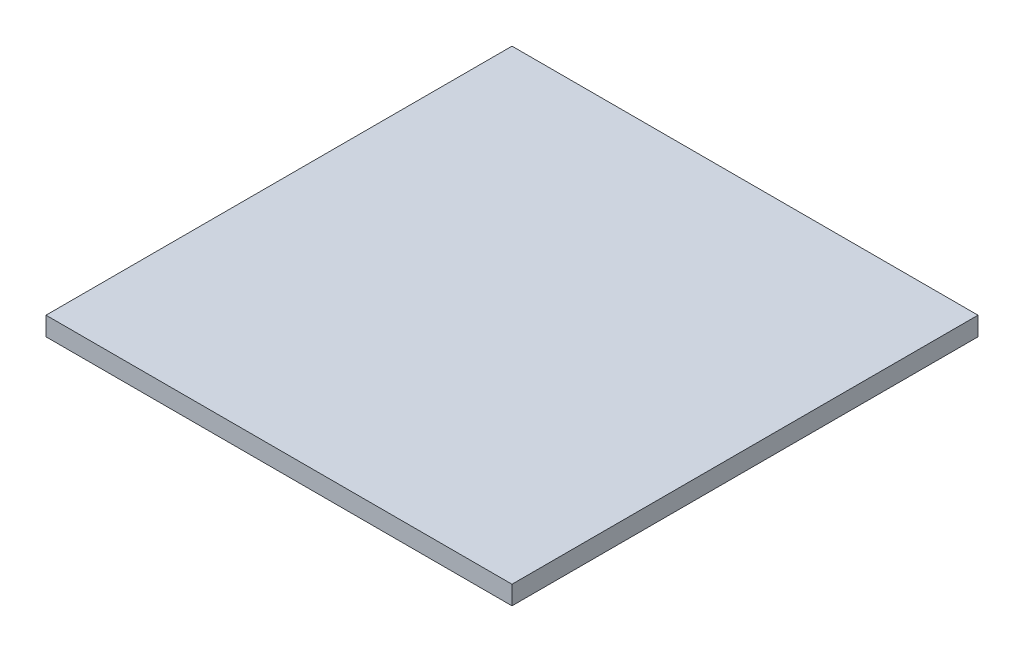
from build123d import *

# Parameters (mm, degrees)
SKETCH1_W      = 39.75
SKETCH1_H      = 1.6
ENVELOPE_DEPTH = 39.75


with BuildPart() as part:
    # Sketch1 → Envelope (new body)
    with BuildSketch(Plane.XY):
        Rectangle(SKETCH1_W, SKETCH1_H)
    extrude(amount=ENVELOPE_DEPTH)


solid = part.part
